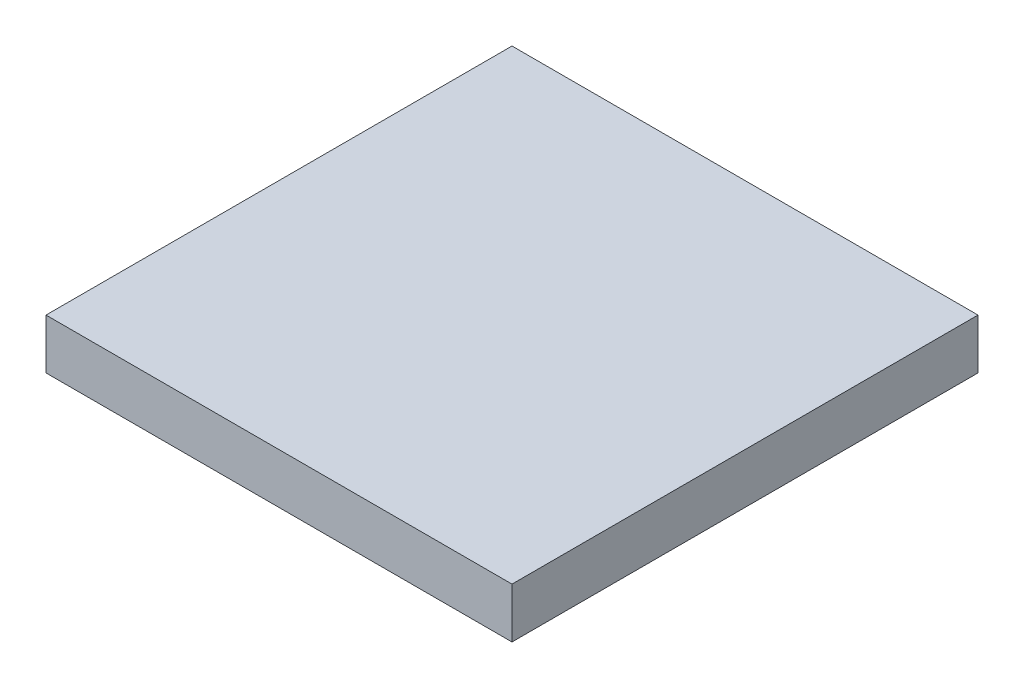
from build123d import *

# Parameters (mm, degrees)
SKETCH1_W           = 158
SKETCH1_H           = 158
SKETCH1_W_2         = 154
SKETCH1_H_2         = 154
BOSS_EXTRUDE1_DEPTH = 15
SKETCH3_W           = 158
SKETCH3_H           = 158
BOSS_EXTRUDE2_DEPTH = 2


with BuildPart() as part:
    # Sketch1 → Boss-Extrude1 (new body)
    with BuildSketch(Plane(origin=(0, 0, 0), x_dir=(1, 0, 0), z_dir=(0, 1, 0))):
        with Locations((77, -70.919584378)):
            Rectangle(SKETCH1_W, SKETCH1_H)
        with Locations((77, -70.919584378)):
            Rectangle(SKETCH1_W_2, SKETCH1_H_2, mode=Mode.SUBTRACT)
    extrude(amount=BOSS_EXTRUDE1_DEPTH)

    # Sketch3 → Boss-Extrude2 (add)
    with BuildSketch(Plane(origin=(0, 15, 0), x_dir=(1, 0, 0), z_dir=(0, 1, 0))):
        with Locations((77, -70.919584378)):
            Rectangle(SKETCH3_W, SKETCH3_H)
    extrude(amount=BOSS_EXTRUDE2_DEPTH)


solid = part.part
